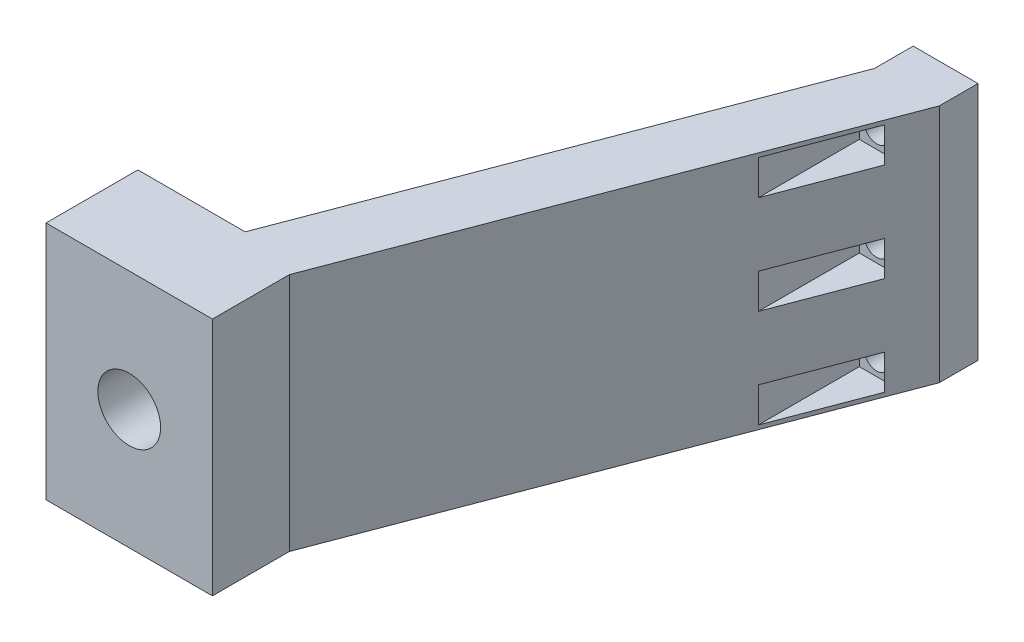
from build123d import *

# Parameters (mm, degrees)
SKETCH4_W           = 16.730770432
SKETCH4_H           = 61.894764582
SKETCH4_R           = 3.048230072
BOSS_EXTRUDE4_DEPTH = 10
BOSS_EXTRUDE5_DEPTH = 61.894764581
SKETCH6_R           = 3.22777379
CUT_EXTRUDE1_DEPTH  = 301.068940686
CUT_EXTRUDE2_START  = 17.78
SKETCH8_W           = 8.976833554
SKETCH8_H           = 8.976833554
CUT_EXTRUDE2_DEPTH  = 30.32
SKETCH9_R           = 3.75
CUT_EXTRUDE3_DEPTH  = 30.32
SKETCH10_R          = 8.1
CUT_EXTRUDE4_DEPTH  = 20


with BuildPart() as part:
    # Sketch4 → Boss-Extrude4 (new body)
    with BuildSketch(Plane.XY):
        with Locations((241.3, -38.1)):
            Rectangle(SKETCH4_W, SKETCH4_H)
        with Locations((241.3, -12.7)):
            Circle(SKETCH4_R, mode=Mode.SUBTRACT)
        with Locations((241.3, -38.1)):
            Circle(SKETCH4_R, mode=Mode.SUBTRACT)
        with Locations((241.3, -63.5)):
            Circle(SKETCH4_R, mode=Mode.SUBTRACT)
    extrude(amount=BOSS_EXTRUDE4_DEPTH)

    # Sketch5 → Boss-Extrude5 (add)
    with BuildSketch(Plane.XZ.offset(69.047382291)):
        Polygon((249.665385216, 10), (203.509422764, 131.615224448), (203.509422764, 151.462944604), (160.545206695, 151.462944604), (160.545206695, 127.74240556), (188.24848215, 127.74240556), (232.934614784, 10), align=None)
    extrude(amount=-BOSS_EXTRUDE5_DEPTH)

    # Sketch6 → Cut-Extrude1 (cut, through all)
    with BuildSketch(Plane(origin=(0, 0, 0), x_dir=(-1, 0, 0), z_dir=(0, 0, -1))):
        with Locations((-241.3, -63.5)):
            Circle(SKETCH6_R)
        with Locations((-241.3, -38.1)):
            Circle(SKETCH6_R)
        with Locations((-241.3, -12.7)):
            Circle(SKETCH6_R)
    extrude(amount=-CUT_EXTRUDE1_DEPTH, mode=Mode.SUBTRACT)

    # Sketch8 → Cut-Extrude2 (cut)
    with BuildSketch(Plane.XY.offset(CUT_EXTRUDE2_START)):
        with Locations((241.3, -63.5)):
            Rectangle(SKETCH8_W, SKETCH8_H)
        with Locations((241.3, -38.1)):
            Rectangle(SKETCH8_W, SKETCH8_H)
        with Locations((241.3, -12.7)):
            Rectangle(SKETCH8_W, SKETCH8_H)
    extrude(amount=CUT_EXTRUDE2_DEPTH, mode=Mode.SUBTRACT)

    # Sketch9 → Cut-Extrude3 (cut)
    with BuildSketch(Plane.XY.offset(151.462944604)):
        with Locations((182.02731473, -38.1)):
            Circle(SKETCH9_R)
    extrude(amount=-CUT_EXTRUDE3_DEPTH, mode=Mode.SUBTRACT)

    # Sketch10 → Cut-Extrude4 (cut)
    with BuildSketch(Plane.XY.offset(151.462944604)):
        with Locations((182.02731473, -38.1)):
            Circle(SKETCH10_R)
    extrude(amount=-CUT_EXTRUDE4_DEPTH, mode=Mode.SUBTRACT)


solid = part.part
